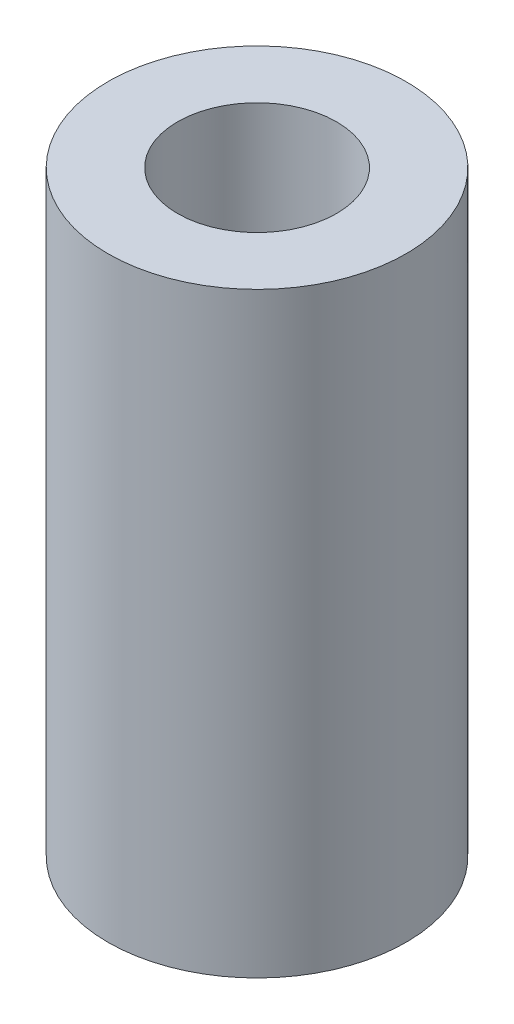
from build123d import *

# Parameters (mm, degrees)
SKETCH1_R           = 3
SKETCH1_R_2         = 1.6
BOSS_EXTRUDE1_DEPTH = 6


with BuildPart() as part:
    # Sketch1 → Boss-Extrude1 (new, symmetric)
    with BuildSketch(Plane(origin=(0, 0, 0), x_dir=(1, 0, 0), z_dir=(0, 1, 0))):
        with Locations(Location((0, 0, 0), (0, 0, 270))):
            Circle(SKETCH1_R)
        with Locations(Location((0, 0, 0), (0, 0, 270))):
            Circle(SKETCH1_R_2, mode=Mode.SUBTRACT)
    extrude(amount=BOSS_EXTRUDE1_DEPTH, both=True)


solid = part.part
